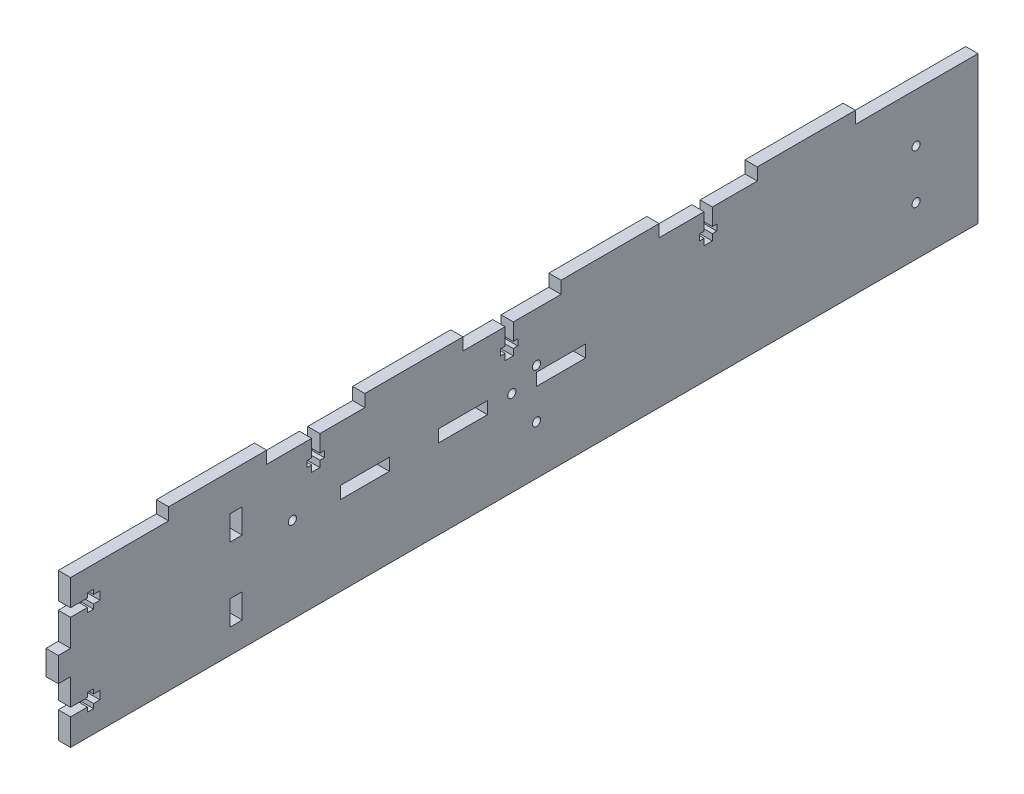
from build123d import *

# Parameters (mm, degrees)
SKETCH1_W           = 6.35
SKETCH1_H           = 76.2
BOSS_EXTRUDE1_DEPTH = 457.2
SKETCH2_W           = 6.35
SKETCH2_H           = 50.8
BOSS_EXTRUDE2_DEPTH = 6.35
SKETCH3_W           = 6.35
SKETCH3_H           = 12.7
CUT_EXTRUDE1_DEPTH  = 460.399570091
SKETCH4_W           = 6.35
SKETCH4_H           = 12.7
BOSS_EXTRUDE4_DEPTH = 6.35
SKETCH7_R           = 2.0955
CUT_EXTRUDE2_DEPTH  = 460.399570091
SKETCH9_R           = 2.0955
SKETCH9_W           = 25.4
SKETCH9_H           = 6.35
CUT_EXTRUDE3_DEPTH  = 6.35
CUT_EXTRUDE4_DEPTH  = 6.35
SKETCH11_W          = 6.35
SKETCH11_H          = 76.2
BOSS_EXTRUDE5_DEPTH = 12.7


with BuildPart() as part:
    # Sketch1 → Boss-Extrude1 (new body)
    with BuildSketch(Plane.XY):
        with Locations((-41.275, 0)):
            Rectangle(SKETCH1_W, SKETCH1_H)
    extrude(amount=-BOSS_EXTRUDE1_DEPTH)

    # Sketch2 → Boss-Extrude2 (add)
    with BuildSketch(Plane(origin=(0, 38.1, 0), x_dir=(1, 0, 0), z_dir=(0, 1, 0))):
        with Locations((-41.275, 381)):
            Rectangle(SKETCH2_W, SKETCH2_H)
        with Locations((-41.275, 279.4)):
            Rectangle(SKETCH2_W, SKETCH2_H)
        with Locations((-41.275, 177.8)):
            Rectangle(SKETCH2_W, SKETCH2_H)
        with Locations((-41.275, 76.2)):
            Rectangle(SKETCH2_W, SKETCH2_H)
    extrude(amount=BOSS_EXTRUDE2_DEPTH)

    # Sketch3 → Cut-Extrude1 (cut, through all)
    with BuildSketch(Plane(origin=(-38.1, 0, 0), x_dir=(0, 0, -1), z_dir=(1, 0, 0))):
        with Locations((85.725, 19.05)):
            Rectangle(SKETCH3_W, SKETCH3_H)
        with Locations((85.725, -19.05)):
            Rectangle(SKETCH3_W, SKETCH3_H)
    extrude(amount=-CUT_EXTRUDE1_DEPTH, mode=Mode.SUBTRACT)

    # Sketch4 → Boss-Extrude4 (add)
    with BuildSketch(Plane.XY):
        with Locations((-41.275, 0)):
            Rectangle(SKETCH4_W, SKETCH4_H)
    extrude(amount=BOSS_EXTRUDE4_DEPTH)

    # Sketch7 → Cut-Extrude2 (cut, through all)
    with BuildSketch(Plane.ZY.offset(44.45)):
        with Locations((-241.3, -12.7)):
            Circle(SKETCH7_R)
        with Locations((-241.3, 12.7)):
            Circle(SKETCH7_R)
        with Locations((-437.8325, -12.7)):
            Circle(SKETCH7_R)
        with Locations((-437.8325, 12.7)):
            Circle(SKETCH7_R)
    extrude(amount=-CUT_EXTRUDE2_DEPTH, mode=Mode.SUBTRACT)

    # Sketch9 → Cut-Extrude3 (cut)
    with BuildSketch(Plane.ZY.offset(44.45)):
        with Locations((-114.880216651, 6.35)):
            Circle(SKETCH9_R)
        with Locations((-228.517018256, 6.35)):
            Circle(SKETCH9_R)
        with Locations((-254, 6.35)):
            Rectangle(SKETCH9_W, SKETCH9_H)
        with Locations((-203.2, 6.35)):
            Rectangle(SKETCH9_W, SKETCH9_H)
        with Locations((-152.4, 6.35)):
            Rectangle(SKETCH9_W, SKETCH9_H)
    extrude(amount=-CUT_EXTRUDE3_DEPTH, mode=Mode.SUBTRACT)

    # Sketch10 → Cut-Extrude4 (cut)
    with BuildSketch(Plane(origin=(-38.1, 0, 0), x_dir=(0, 0, -1), z_dir=(1, 0, 0))):
        Polygon((0, 24.548534751), (0, 20.281334751), (8.763, 20.281334751), (8.763, 17.969934751), (11.938, 17.969934751), (11.938, 20.281334751), (15.24, 20.281334751), (15.24, 24.548534751), (11.938, 24.548534751), (11.938, 26.859934751), (8.763, 26.859934751), (8.763, 24.548534751), align=None)
        Polygon((0, -20.0914), (0, -24.3586), (8.763, -24.3586), (8.763, -26.67), (11.938, -26.67), (11.938, -24.3586), (15.24, -24.3586), (15.24, -20.0914), (11.938, -20.0914), (11.938, -17.78), (8.763, -17.78), (8.763, -20.0914), align=None)
        Polygon((332.3336, 38.1), (328.0664, 38.1), (328.0664, 29.337), (325.755, 29.337), (325.755, 26.162), (328.0664, 26.162), (328.0664, 22.86), (332.3336, 22.86), (332.3336, 26.162), (334.645, 26.162), (334.645, 29.337), (332.3336, 29.337), align=None)
        Polygon((229.270305867, 38.1), (225.003105867, 38.1), (225.003105867, 29.337), (222.691705867, 29.337), (222.691705867, 26.162), (225.003105867, 26.162), (225.003105867, 22.86), (229.270305867, 22.86), (229.270305867, 26.162), (231.581705867, 26.162), (231.581705867, 29.337), (229.270305867, 29.337), align=None)
        Polygon((129.1336, 38.1), (124.8664, 38.1), (124.8664, 29.337), (122.555, 29.337), (122.555, 26.162), (124.8664, 26.162), (124.8664, 22.86), (129.1336, 22.86), (129.1336, 26.162), (131.445, 26.162), (131.445, 29.337), (129.1336, 29.337), align=None)
    extrude(amount=-CUT_EXTRUDE4_DEPTH, mode=Mode.SUBTRACT)

    # Sketch11 → Boss-Extrude5 (add)
    with BuildSketch(Plane(origin=(0, 0, -457.2), x_dir=(-1, 0, 0), z_dir=(0, 0, -1))):
        with Locations((41.275, 0)):
            Rectangle(SKETCH11_W, SKETCH11_H)
    extrude(amount=BOSS_EXTRUDE5_DEPTH)


solid = part.part
